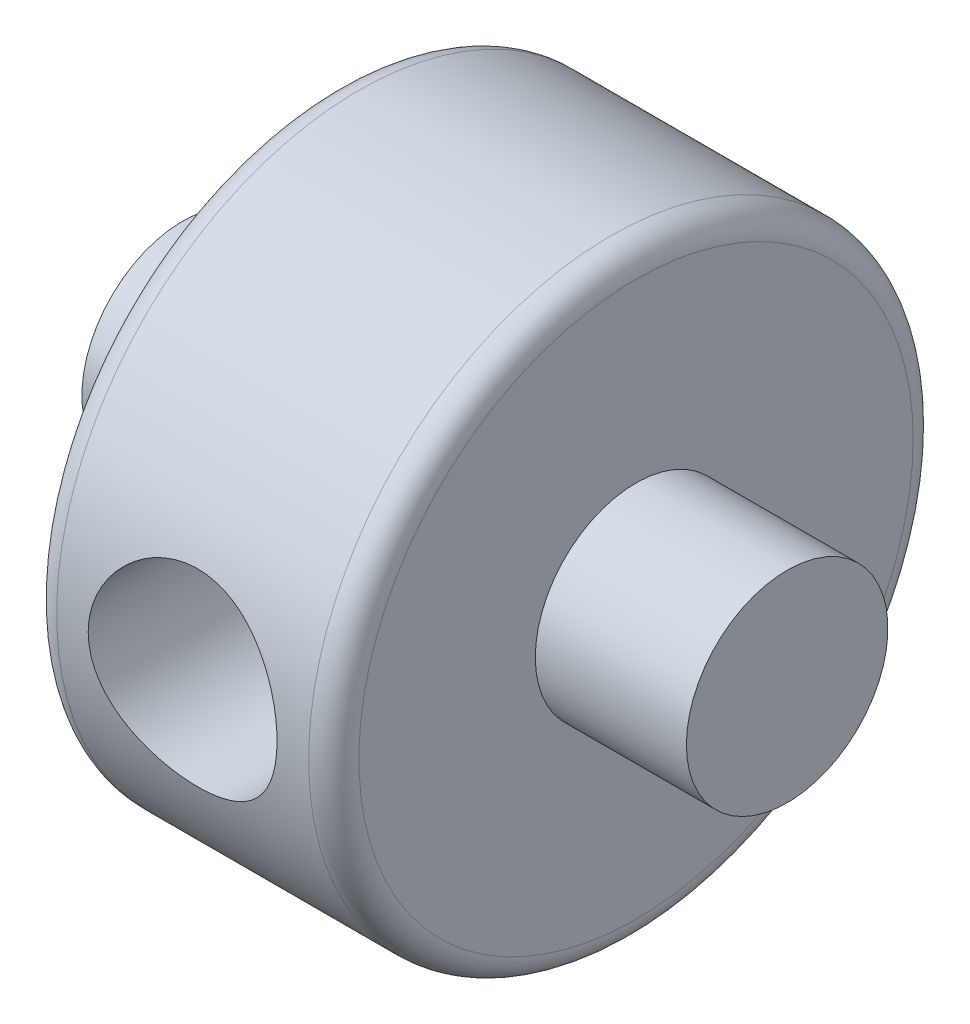
from build123d import *

# Parameters (mm, degrees)
SKETCH1_R           = 9.525
BOSS_EXTRUDE1_DEPTH = 4.7625
SKETCH2_R           = 3.175
BOSS_EXTRUDE2_DEPTH = 4.7625
FILLET1_R           = 0.79248
BOSS_EXTRUDE3_START = 4.7625
SKETCH3_R           = 3.175
BOSS_EXTRUDE3_DEPTH = 4.7625
SKETCH13_R          = 2.97561
CUT_EXTRUDE1_DEPTH  = 17.497784


with BuildPart() as part:
    # Sketch1 → Boss-Extrude1 (new, symmetric)
    with BuildSketch(Plane(origin=(0, 0, 0), x_dir=(0, 0, -1), z_dir=(1, 0, 0))):
        with Locations(Location((0, 0, 0), (0, 0, 180))):
            Circle(SKETCH1_R)
    extrude(amount=BOSS_EXTRUDE1_DEPTH, both=True)

    # Sketch2 → Boss-Extrude2 (add)
    with BuildSketch(Plane(origin=(4.7625, 0, 0), x_dir=(0, 0, -1), z_dir=(1, 0, 0))):
        with Locations(Location((0, 0, 0), (0, 0, 180))):
            Circle(SKETCH2_R)
    extrude(amount=BOSS_EXTRUDE2_DEPTH)

    # Fillet1
    fillet1_edges = [part.edges().sort_by_distance(p)[0] for p in [
        (-4.7625, 0, -9.525),
        (4.7625, 0, -9.525),
    ]]
    fillet(fillet1_edges, radius=FILLET1_R)

    # Sketch3 → Boss-Extrude3 (add)
    with BuildSketch(Plane.ZY.offset(4.7625).offset(BOSS_EXTRUDE3_START)):
        Circle(SKETCH3_R)
    extrude(amount=-BOSS_EXTRUDE3_DEPTH)

    # Sketch13 → Cut-Extrude1 (cut, through all)
    with BuildSketch(Plane.XY):
        with Locations(Location((0, 0, 0), (0, 0, 180))):
            Circle(SKETCH13_R)
    extrude(amount=CUT_EXTRUDE1_DEPTH, mode=Mode.SUBTRACT)


solid = part.part
